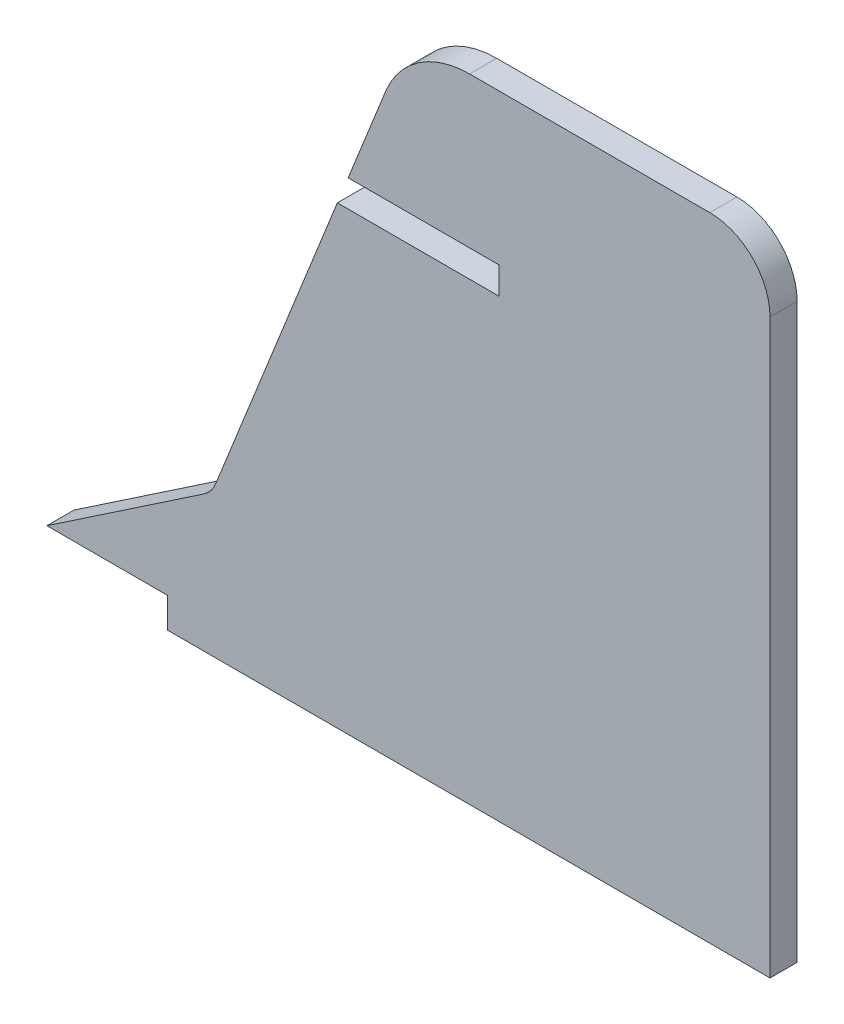
from build123d import *

# Parameters (mm, degrees)
BOSS_EXTRUDE1_DEPTH = 4.5
FILLET1_R           = 5
FILLET2_R           = 10
FILLET3_R           = 15


with BuildPart() as part:
    # Sketch1 → Boss-Extrude1 (new body)
    with BuildSketch(Plane.XY):
        Polygon((7.4, 18.5), (28.2, 70.5), (55, 70.5), (55, 75), (30, 75), (40, 100), (100, 100), (100, 0), (100, -5), (0, -5), (0, 0), (-20, 0), align=None)
    extrude(amount=BOSS_EXTRUDE1_DEPTH)

    # Fillet1
    fillet1_edges = [part.edges().sort_by_distance(p)[0] for p in [
        (7.4, 18.5, 2.25),
    ]]
    fillet(fillet1_edges, radius=FILLET1_R)

    # Fillet2
    fillet2_edges = [part.edges().sort_by_distance(p)[0] for p in [
        (100, 100, 2.25),
    ]]
    fillet(fillet2_edges, radius=FILLET2_R)

    # Fillet3
    fillet3_edges = [part.edges().sort_by_distance(p)[0] for p in [
        (40, 100, 2.25),
    ]]
    fillet(fillet3_edges, radius=FILLET3_R)


solid = part.part
